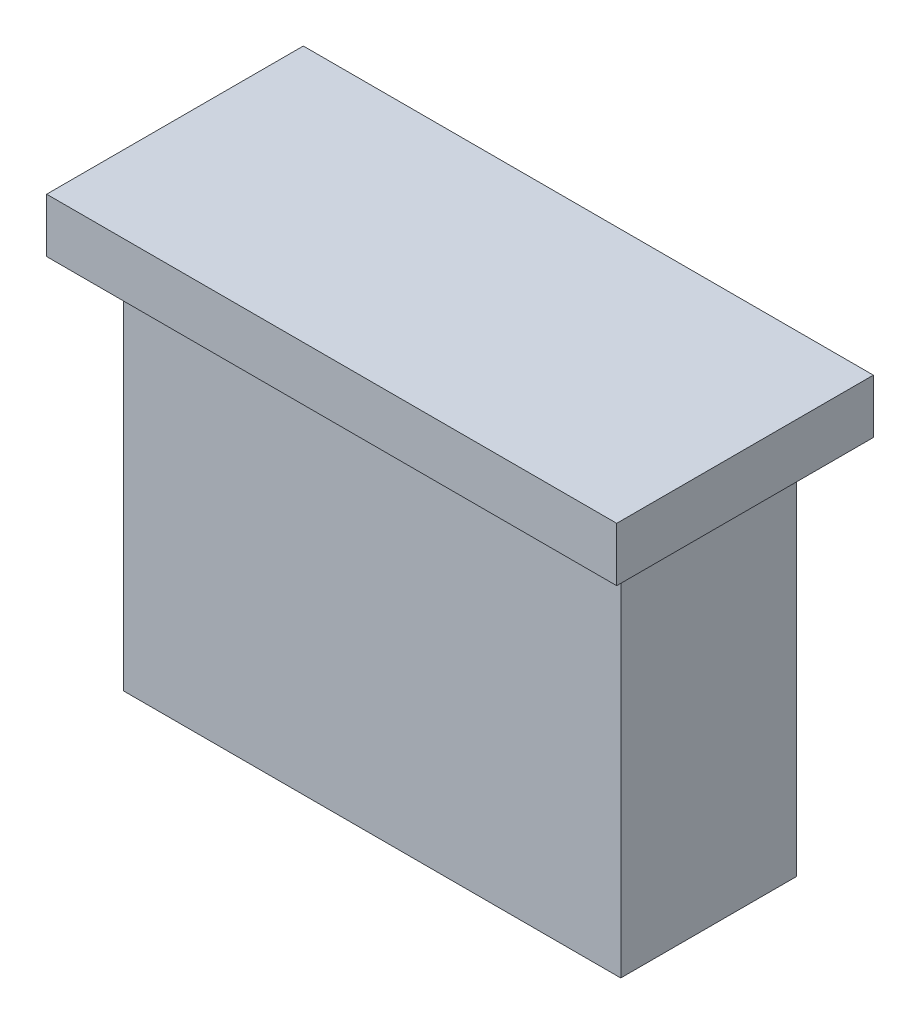
from build123d import *

# Parameters (mm, degrees)
SKETCH1_W           = 18.4
SKETCH1_H           = 6.5
BOSS_EXTRUDE1_DEPTH = 14
SKETCH2_W           = 21.1
SKETCH2_H           = 9.5
BOSS_EXTRUDE2_DEPTH = 2


with BuildPart() as part:
    # Sketch1 → Boss-Extrude1 (new body)
    with BuildSketch(Plane(origin=(0, 0, 0), x_dir=(1, 0, 0), z_dir=(0, 1, 0))):
        Rectangle(SKETCH1_W, SKETCH1_H)
    extrude(amount=BOSS_EXTRUDE1_DEPTH)

    # Sketch2 → Boss-Extrude2 (add)
    with BuildSketch(Plane(origin=(0, 14, 0), x_dir=(1, 0, 0), z_dir=(0, 1, 0))):
        Rectangle(SKETCH2_W, SKETCH2_H)
    extrude(amount=BOSS_EXTRUDE2_DEPTH)


solid = part.part
